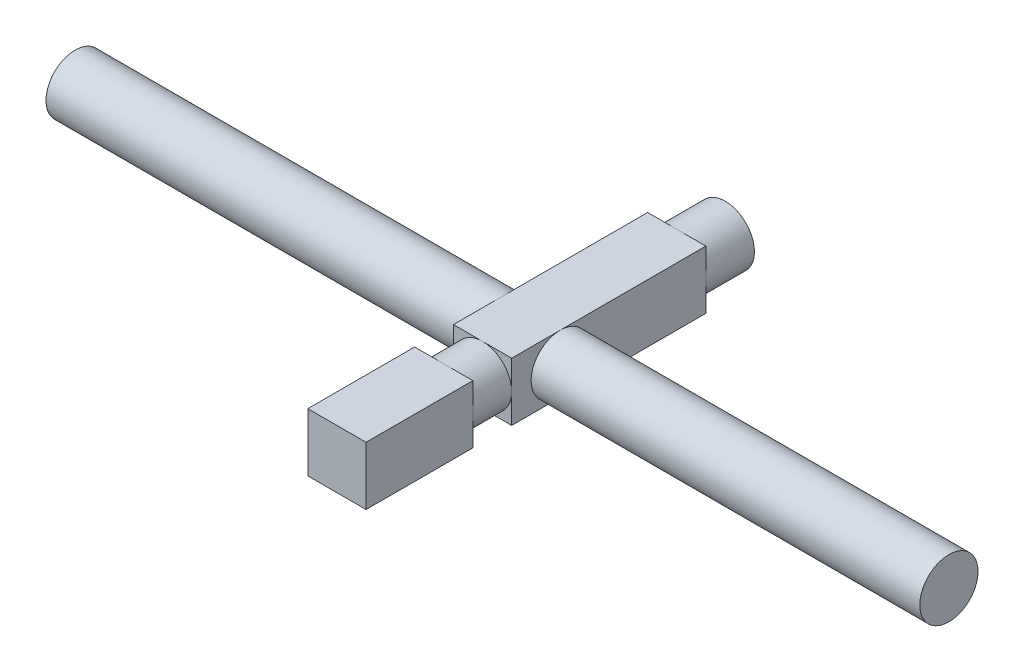
from build123d import *

# Parameters (mm, degrees)
SKETCH_1_W               = 90
SKETCH_1_H               = 3
EXTRUDE_1_DEPTH          = 3
EXTRUDE_1_DEPTH_BACK     = 3
SKETCH_2_W               = 40
SKETCH_2_H               = 6
CUT_EXTRUDE_1_DEPTH      = 5
CUT_EXTRUDE_5_DEPTH      = 1
CUT_EXTRUDE_5_DEPTH_BACK = 3
SKETCH_4_OUTSIDE_W       = 111.734
SKETCH_4_OUTSIDE_H       = 27.734
SKETCH_4_OUTSIDE_R       = 3


with BuildPart() as part:
    # 草图1 → 旋转1 (revolve)
    with BuildSketch(Plane.XY, mode=Mode.PRIVATE) as revolve_1_sk:
        with Locations((-1.966019417, 1.5)):
            Rectangle(SKETCH_1_W, SKETCH_1_H)
    revolve(revolve_1_sk.sketch.rotate(Axis((-46.966019417, 0, 0), (1, 0, 0)), 90), axis=Axis((-46.966019417, 0, 0), (1, 0, 0)))

    # 草图2 → 凸台-拉伸1 (add, two sides: drawn at the far end of the back side and taken through both)
    with BuildSketch(Plane(origin=(0, 0, 0), x_dir=(0, 0, -1), z_dir=(1, 0, 0)).offset(-EXTRUDE_1_DEPTH_BACK)):
        Rectangle(SKETCH_2_W, SKETCH_2_H)
    extrude(amount=EXTRUDE_1_DEPTH + EXTRUDE_1_DEPTH_BACK)

    # 草图3 → 切除-拉伸1 (cut)
    with BuildSketch(Plane(origin=(0, 0, -20), x_dir=(-1, 0, 0), z_dir=(0, 0, -1))):
        with BuildLine():
            Line((-3, 3), (-3, 0))
            ThreePointArc((-3, 0), (-2.121320344, 2.121320344), (0, 3))
            Line((0, 3), (-3, 3))
        make_face()
        with BuildLine():
            ThreePointArc((0, 3), (2.121320344, 2.121320344), (3, 0))
            Line((3, 0), (3, 3))
            Line((3, 3), (0, 3))
        make_face()
        with BuildLine():
            Line((-3, -3), (0, -3))
            ThreePointArc((0, -3), (-2.121320344, -2.121320344), (-3, 0))
            Line((-3, 0), (-3, -3))
        make_face()
        with BuildLine():
            Line((0, -3), (3, -3))
            Line((3, -3), (3, 0))
            ThreePointArc((3, 0), (2.121320344, -2.121320344), (0, -3))
        make_face()
    extrude(amount=-CUT_EXTRUDE_1_DEPTH, mode=Mode.SUBTRACT)

    # 草图4 outside → 切除-拉伸5 (cut, two sides: drawn at the far end of the back side and taken through both)
    with BuildSketch(Plane.XY.offset(8).offset(-CUT_EXTRUDE_5_DEPTH_BACK)):
        with Locations((-1.966, 0)):
            Rectangle(SKETCH_4_OUTSIDE_W, SKETCH_4_OUTSIDE_H)
        with Locations(Location((0, 0, 0), (0, 0, 180))):
            Circle(SKETCH_4_OUTSIDE_R, mode=Mode.SUBTRACT)
    extrude(amount=CUT_EXTRUDE_5_DEPTH + CUT_EXTRUDE_5_DEPTH_BACK, mode=Mode.SUBTRACT)


solid = part.part
